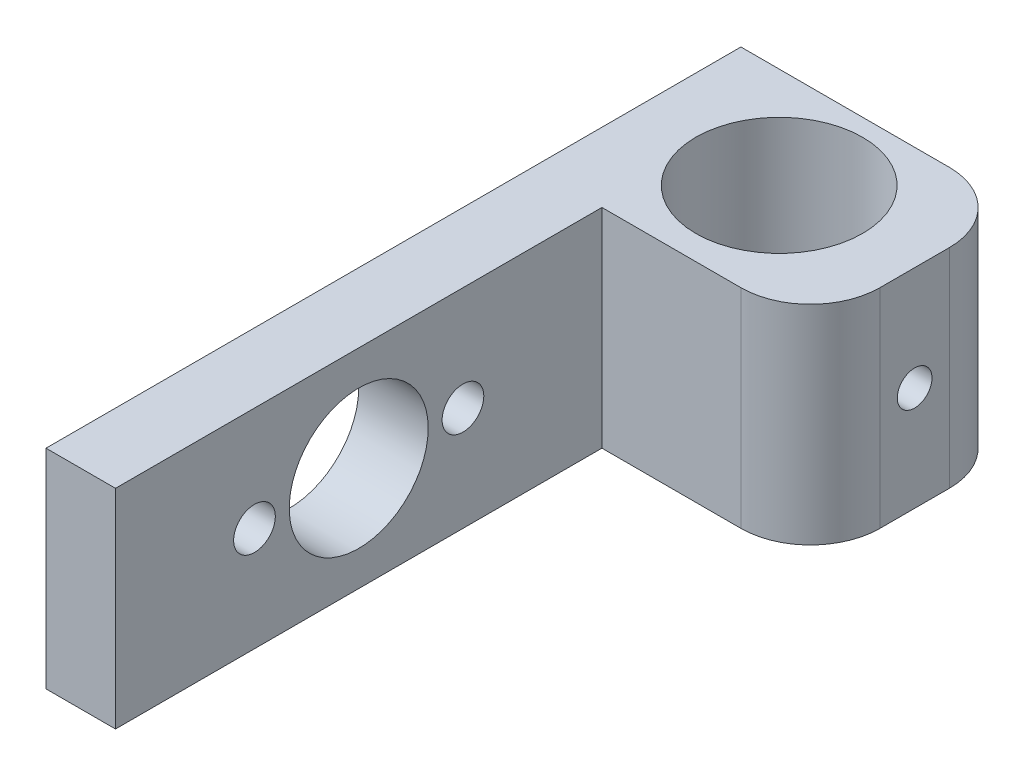
from build123d import *

# Parameters (mm, degrees)
SKETCH1_W           = 50
SKETCH1_H           = 15
SKETCH1_R           = 1.5
SKETCH1_R_2         = 5
BOSS_EXTRUDE1_DEPTH = 2.5
SKETCH2_R           = 6
CUT_EXTRUDE1_DEPTH  = 1000
SKETCH5_W           = 20
SKETCH5_H           = 15
BOSS_EXTRUDE2_DEPTH = 15
SKETCH2_5_R         = 6
CUT_EXTRUDE2_DEPTH  = 15
FILLET1_R           = 5
SKETCH6_R           = 1.25
CUT_EXTRUDE3_DEPTH  = 15


with BuildPart() as part:
    # Sketch1 → Boss-Extrude1 (new, symmetric)
    with BuildSketch(Plane(origin=(0, 0, 0), x_dir=(0, 0, -1), z_dir=(1, 0, 0))):
        with Locations((25, 7.5)):
            Rectangle(SKETCH1_W, SKETCH1_H)
        with Locations((10, 7.5)):
            Circle(SKETCH1_R, mode=Mode.SUBTRACT)
        with Locations((17.5, 7.5)):
            Circle(SKETCH1_R_2, mode=Mode.SUBTRACT)
        with Locations((25, 7.5)):
            Circle(SKETCH1_R, mode=Mode.SUBTRACT)
    extrude(amount=BOSS_EXTRUDE1_DEPTH, both=True)

    # Sketch2 → Cut-Extrude1 (cut)
    with BuildSketch(Plane(origin=(0, 15, 0), x_dir=(1, 0, 0), z_dir=(0, 1, 0))):
        with Locations((7.5, 42.75390625)):
            Circle(SKETCH2_R)
    extrude(amount=-CUT_EXTRUDE1_DEPTH, mode=Mode.SUBTRACT)

    # Sketch5 → Boss-Extrude2 (add)
    with BuildSketch(Plane(origin=(0, 15, 0), x_dir=(1, 0, 0), z_dir=(0, 1, 0))):
        with Locations((7.5, 42.5)):
            Rectangle(SKETCH5_W, SKETCH5_H)
    extrude(amount=-BOSS_EXTRUDE2_DEPTH)

    # Sketch2<5> → Cut-Extrude2 (cut)
    with BuildSketch(Plane(origin=(0, 15, 0), x_dir=(1, 0, 0), z_dir=(0, 1, 0))):
        with Locations((7.5, 42.75390625)):
            Circle(SKETCH2_5_R)
    extrude(amount=-CUT_EXTRUDE2_DEPTH, mode=Mode.SUBTRACT)

    # Fillet1
    fillet1_edges = [part.edges().sort_by_distance(p)[0] for p in [
        (17.5, 7.5, -35),
        (17.5, 7.5, -50),
    ]]
    fillet(fillet1_edges, radius=FILLET1_R)

    # Sketch6 → Cut-Extrude3 (cut)
    with BuildSketch(Plane(origin=(17.5, 0, 0), x_dir=(0, 0, -1), z_dir=(1, 0, 0))):
        with Locations((42.5, 7.5)):
            Circle(SKETCH6_R)
    extrude(amount=-CUT_EXTRUDE3_DEPTH, mode=Mode.SUBTRACT)


solid = part.part
